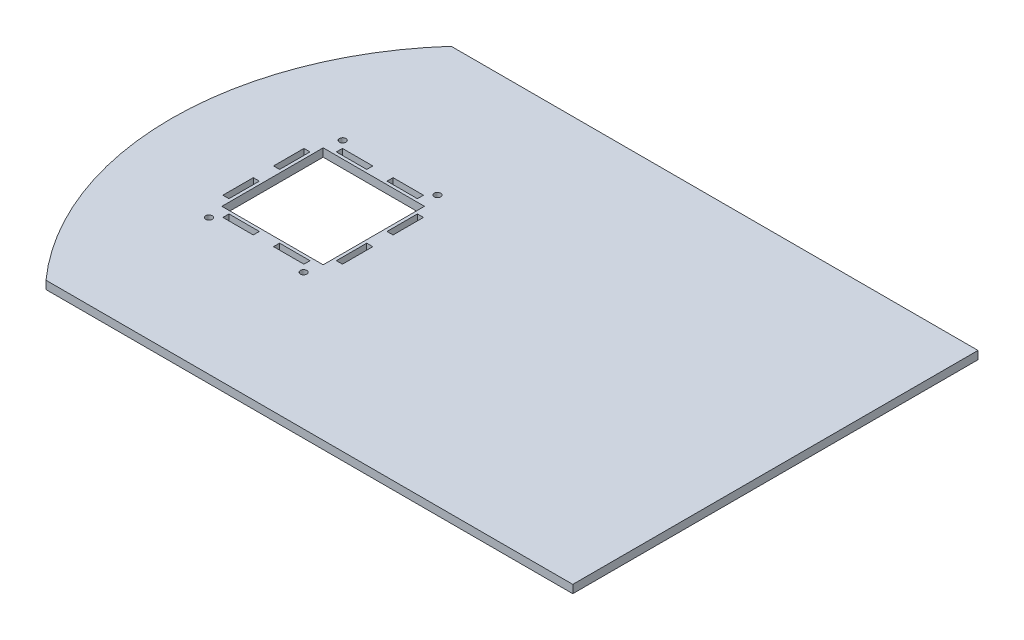
from build123d import *

# Parameters (mm, degrees)
SKETCH1_R           = 1.6
SKETCH1_W           = 50
SKETCH1_H           = 50
SKETCH1_W_2         = 15
SKETCH1_H_2         = 3
SKETCH1_W_3         = 3
SKETCH1_H_3         = 15
BOSS_EXTRUDE1_DEPTH = 4


with BuildPart() as part:
    # Sketch1 → Boss-Extrude1 (new body)
    with BuildSketch(Plane(origin=(37.559096252, 0, 0), x_dir=(1, 0, 0), z_dir=(0, 1, 0))):
        with BuildLine():
            Line((48.217114977, 152.653937947), (48.217114977, -47.346062053))
            Line((48.217114977, -47.346062053), (-211.782885023, -47.346062053))
            ThreePointArc((-211.782885023, -47.346062053), (-240.105339993, -0.869375518), (-249.979486148, 52.653937947))
            ThreePointArc((-249.979486148, 52.653937947), (-240.105339993, 106.177251413), (-211.782885023, 152.653937947))
            Line((-211.782885023, 152.653937947), (48.217114977, 152.653937947))
        make_face()
        with Locations(Location((-198.353137603, 19.653937947, 0), (0, 0, 270))):
            Circle(SKETCH1_R, mode=Mode.SUBTRACT)
        with Locations(Location((-151.605834694, 19.653937947, 0), (0, 0, 90))):
            Circle(SKETCH1_R, mode=Mode.SUBTRACT)
        with Locations(Location((-198.353137603, 85.653937947, 0), (0, 0, 90))):
            Circle(SKETCH1_R, mode=Mode.SUBTRACT)
        with Locations(Location((-151.605834694, 85.653937947, 0), (0, 0, 270))):
            Circle(SKETCH1_R, mode=Mode.SUBTRACT)
        with Locations((-174.979486148, 52.653937947)):
            Rectangle(SKETCH1_W, SKETCH1_H, mode=Mode.SUBTRACT)
        with Locations((-187.479486148, 80.653937947)):
            Rectangle(SKETCH1_W_2, SKETCH1_H_2, mode=Mode.SUBTRACT)
        with Locations((-187.479486148, 24.653937947)):
            Rectangle(SKETCH1_W_2, SKETCH1_H_2, mode=Mode.SUBTRACT)
        with Locations((-162.479486148, 24.653937947)):
            Rectangle(SKETCH1_W_2, SKETCH1_H_2, mode=Mode.SUBTRACT)
        with Locations((-162.479486148, 80.653937947)):
            Rectangle(SKETCH1_W_2, SKETCH1_H_2, mode=Mode.SUBTRACT)
        with Locations((-146.979486148, 40.153937947)):
            Rectangle(SKETCH1_W_3, SKETCH1_H_3, mode=Mode.SUBTRACT)
        with Locations((-146.979486148, 65.153937947)):
            Rectangle(SKETCH1_W_3, SKETCH1_H_3, mode=Mode.SUBTRACT)
        with Locations((-202.979486148, 40.153937947)):
            Rectangle(SKETCH1_W_3, SKETCH1_H_3, mode=Mode.SUBTRACT)
        with Locations((-202.979486148, 65.153937947)):
            Rectangle(SKETCH1_W_3, SKETCH1_H_3, mode=Mode.SUBTRACT)
    extrude(amount=BOSS_EXTRUDE1_DEPTH)


solid = part.part
